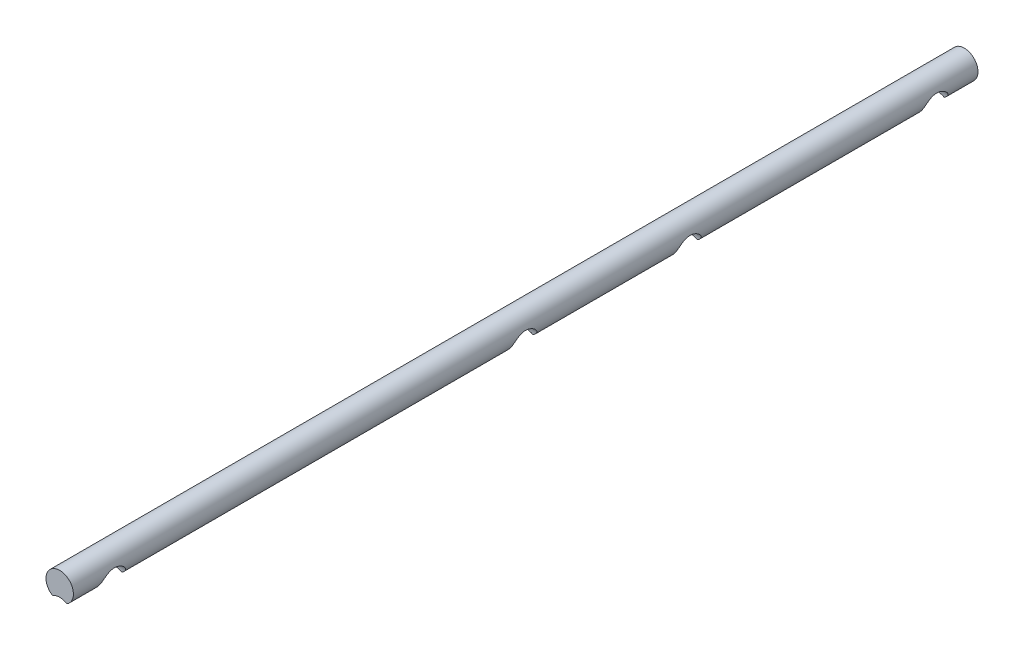
from build123d import *

# Parameters (mm, degrees)
EXTRUDE_1_DEPTH     = 3300
SKETCH_2_R          = 100
CUT_EXTRUDE_1_DEPTH = 3000


with BuildPart() as part:
    # Эскиз1 → Бобышка-Вытянуть1 (new, symmetric)
    with BuildSketch(Plane.XY):
        with BuildLine():
            ThreePointArc((100, 0), (70.710678119, 70.710678119), (0, 100))
            Line((0, 100), (0, -70))
            ThreePointArc((0, -70), (27.658633372, -73.708341903), (53.363596856, -84.571428571))
            ThreePointArc((53.363596856, -84.571428571), (87.568143995, -48.288923753), (100, 0))
        make_face()
        with BuildLine():
            Line((0, -70), (0, 100))
            ThreePointArc((0, 100), (-96.065453877, 27.774602993), (-53.363596856, -84.571428571))
            ThreePointArc((-53.363596856, -84.571428571), (-27.658633372, -73.708341903), (0, -70))
        make_face()
        with BuildLine():
            ThreePointArc((100, 0), (70.710678119, 70.710678119), (0, 100))
            Line((0, 100), (0, -70))
            ThreePointArc((0, -70), (27.658633372, -73.708341903), (53.363596856, -84.571428571))
            ThreePointArc((53.363596856, -84.571428571), (87.568143995, -48.288923753), (100, 0))
        make_face()
        with BuildLine():
            Line((0, -70), (0, 100))
            ThreePointArc((0, 100), (-96.065453877, 27.774602993), (-53.363596856, -84.571428571))
            ThreePointArc((-53.363596856, -84.571428571), (-27.658633372, -73.708341903), (0, -70))
        make_face()
    extrude(amount=EXTRUDE_1_DEPTH, both=True)

    # Эскиз2 → Вырез-Вытянуть1 (cut, symmetric)
    with BuildSketch(Plane(origin=(0, 0, 0), x_dir=(0, 0, -1), z_dir=(1, 0, 0))):
        with Locations((-3000, -84.571428571)):
            Circle(SKETCH_2_R)
        with Locations((3000, -84.571428571)):
            Circle(SKETCH_2_R)
        with Locations((0, -84.571428571)):
            Circle(SKETCH_2_R)
        with Locations((1200, -84.571428571)):
            Circle(SKETCH_2_R)
    extrude(amount=CUT_EXTRUDE_1_DEPTH, both=True, mode=Mode.SUBTRACT)


solid = part.part
